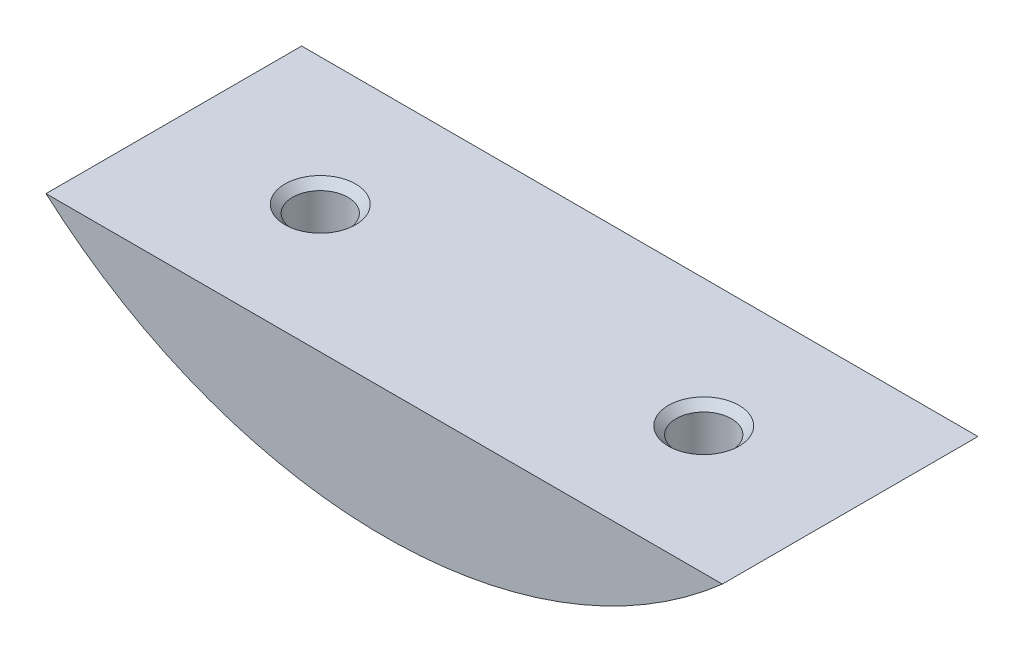
from build123d import *

# Parameters (mm, degrees)
BOSS_EXTRUDE1_DEPTH     = 25.4
CUT_EXTRUDE1_DEPTH      = 73.955945611
CUT_EXTRUDE1_DEPTH_BACK = 73.955945611
SKETCH2_R               = 2
SKETCH3_R               = 2.75
CUT_EXTRUDE2_DEPTH      = 73.955945755
CHAMFER1_SIZE           = 0.762


with BuildPart() as part:
    # Sketch1 → Boss-Extrude1 (new body)
    with BuildSketch(Plane.XY):
        with BuildLine():
            Line((0, 0), (67.202083301, 0))
            ThreePointArc((67.202083301, 0), (33.601041651, -12.7), (0, 0))
        make_face()
    extrude(amount=BOSS_EXTRUDE1_DEPTH)

    # Sketch2 → Cut-Extrude1 (cut, two sides: drawn at the far end of the back side and taken through both)
    with BuildSketch(Plane(origin=(0, 0, 0), x_dir=(1, 0, 0), z_dir=(0, 1, 0)).offset(-CUT_EXTRUDE1_DEPTH_BACK)):
        with Locations(Location((14.551041651, -12.7, 0), (0, 0, 270))):
            Circle(SKETCH2_R)
        with Locations(Location((52.651041651, -12.7, 0), (0, 0, 270))):
            Circle(SKETCH2_R)
    extrude(amount=CUT_EXTRUDE1_DEPTH + CUT_EXTRUDE1_DEPTH_BACK, mode=Mode.SUBTRACT)

    # Sketch3 → Cut-Extrude2 (cut, through all)
    with BuildSketch(Plane(origin=(0, 0, 0), x_dir=(1, 0, 0), z_dir=(0, 1, 0))):
        with Locations(Location((14.551041651, -12.7, 0), (0, 0, 270))):
            Circle(SKETCH3_R)
        with Locations(Location((52.651041651, -12.7, 0), (0, 0, 270))):
            Circle(SKETCH3_R)
    extrude(amount=-CUT_EXTRUDE2_DEPTH, mode=Mode.SUBTRACT)

    # Chamfer1
    chamfer1_edges = [part.edges().sort_by_distance(p)[0] for p in [
        (14.551041651, 0, 9.95),
        (52.651041651, 0, 9.95),
    ]]
    chamfer(chamfer1_edges, length=CHAMFER1_SIZE)


solid = part.part
